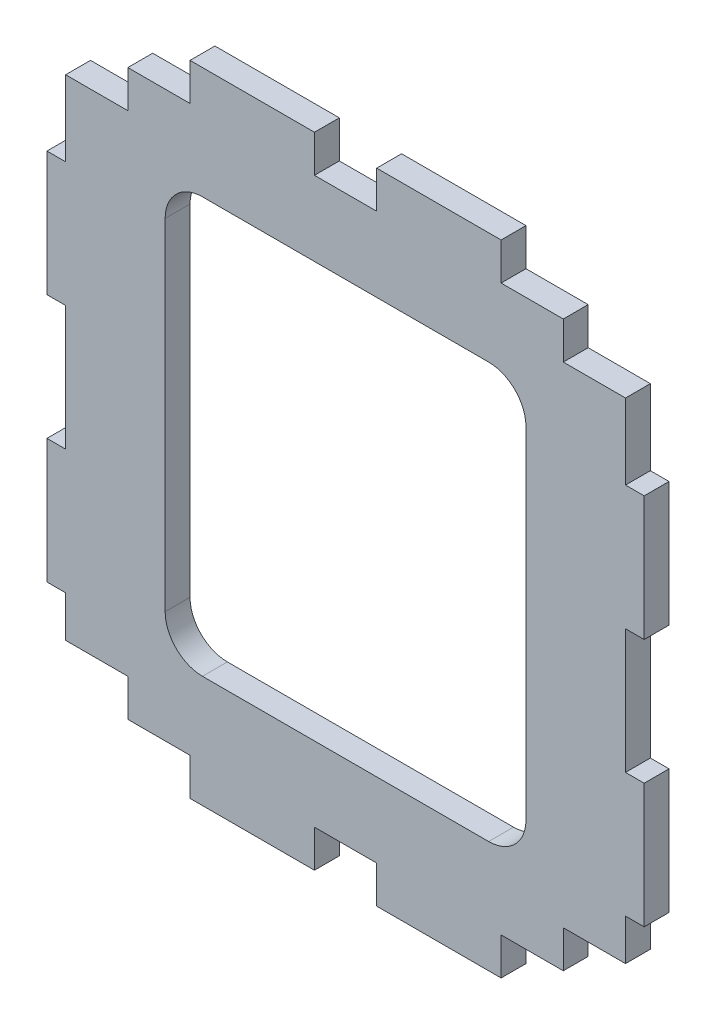
from build123d import *

# Parameters (mm, degrees)
EXTRUDE_1_DEPTH = 2


with BuildPart() as part:
    # Model → 凸台-拉伸1 (new body)
    with BuildSketch(Plane.XY):
        Polygon((682.151439572, 151.342718787), (685.151439572, 151.342718787), (685.151439572, 154.342718787), (690.151439572, 154.342718787), (690.151439572, 157.342718787), (700.151439572, 157.342718787), (700.151439572, 154.342718787), (705.151439572, 154.342718787), (705.151439572, 157.342718787), (715.151439572, 157.342718787), (715.151439572, 154.342718787), (720.151439572, 154.342718787), (720.151439572, 151.342718787), (723.151439572, 151.342718787), (725.151439572, 151.342718787), (725.151439572, 145.282718787), (726.651439572, 145.282718787), (726.651439572, 135.282718787), (725.151439572, 135.282718787), (725.151439572, 130.072718787), (725.151439572, 125.282718787), (726.651439572, 125.282718787), (726.651439572, 115.282718787), (725.151439572, 115.282718787), (725.151439572, 111.972718787), (720.151439572, 111.972718787), (720.151439572, 108.972718787), (715.151439572, 108.972718787), (715.151439572, 105.972718787), (705.151439572, 105.972718787), (705.151439572, 108.972718787), (700.151439572, 108.972718787), (700.151439572, 105.972718787), (690.151439572, 105.972718787), (690.151439572, 108.972718787), (685.151439572, 108.972718787), (685.151439572, 111.972718787), (680.151439572, 111.972718787), (680.151439572, 115.282718787), (678.651439572, 115.282718787), (678.651439572, 125.282718787), (680.151439572, 125.282718787), (680.151439572, 130.072718787), (680.151439572, 135.282718787), (678.651439572, 135.282718787), (678.651439572, 145.282718787), (680.151439572, 145.282718787), (680.151439572, 151.342718787), align=None)
        with BuildLine():
            Line((714.151439572, 148.342718787), (691.151439572, 148.342718787))
            ThreePointArc((691.151439572, 148.342718787), (689.030119228, 147.46403913), (688.151439572, 145.342718787))
            Line((688.151439572, 145.342718787), (688.151439572, 117.972718787))
            ThreePointArc((688.151439572, 117.972718787), (689.030119228, 115.851398443), (691.151439572, 114.972718787))
            Line((691.151439572, 114.972718787), (714.151439572, 114.972718787))
            ThreePointArc((714.151439572, 114.972718787), (716.272759915, 115.851398443), (717.151439572, 117.972718787))
            Line((717.151439572, 117.972718787), (717.151439572, 145.342718787))
            ThreePointArc((717.151439572, 145.342718787), (716.272759915, 147.46403913), (714.151439572, 148.342718787))
        make_face(mode=Mode.SUBTRACT)
    extrude(amount=EXTRUDE_1_DEPTH)


solid = part.part
